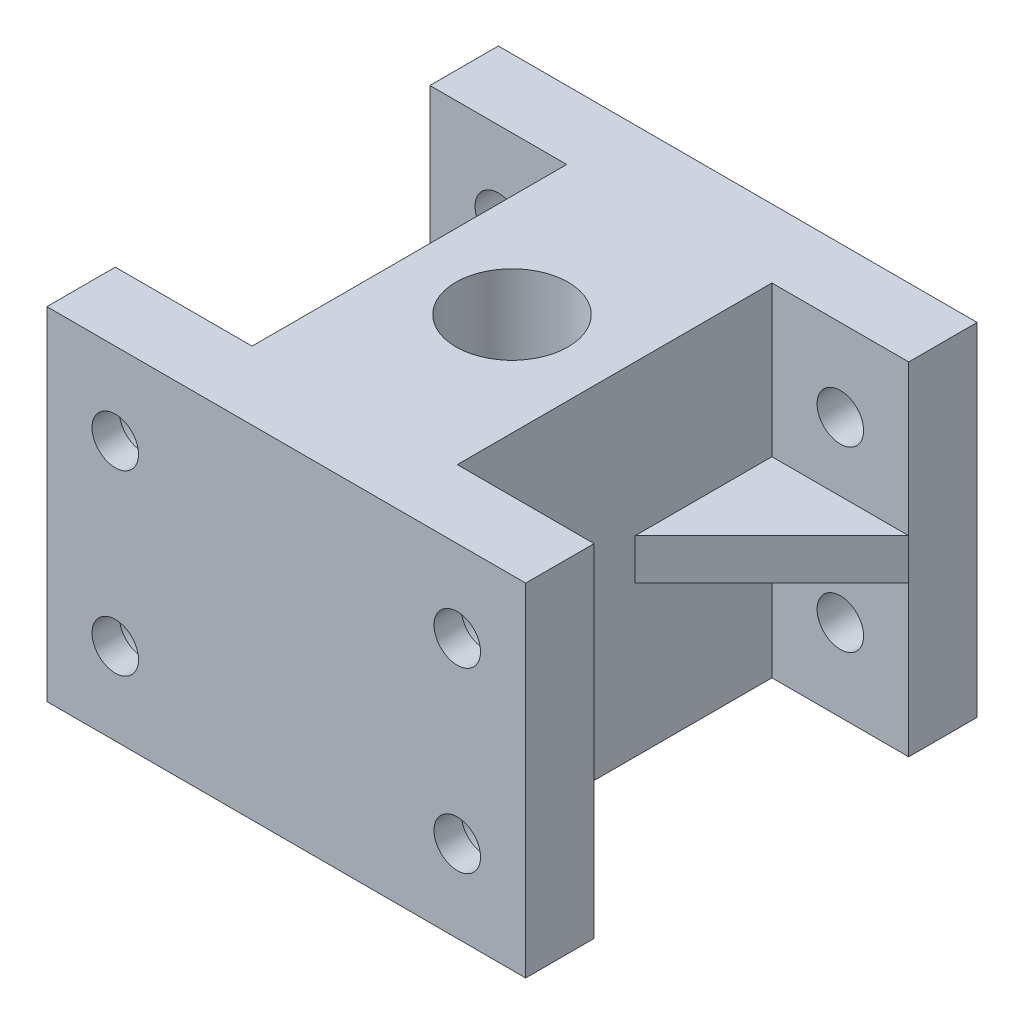
from build123d import *

# Parameters (mm, degrees)
SKETCH1_W           = 35
SKETCH1_H           = 25
SKETCH1_R           = 1.7
BOSS_EXTRUDE1_DEPTH = 5
BOSS_EXTRUDE2_DEPTH = 25
SKETCH4_R           = 1.7
CUT_EXTRUDE1_DEPTH  = 5
SKETCH5_R           = 3
SKETCH5_R_2         = 1.7
CUT_EXTRUDE3_DEPTH  = 3
BOSS_EXTRUDE3_DEPTH = 2
BOSS_EXTRUDE4_DEPTH = 1.5


with BuildPart() as part:
    # Sketch1 → Boss-Extrude1 (new body)
    with BuildSketch(Plane.XY):
        with Locations((10.173766162, 223.42362241)):
            Rectangle(SKETCH1_W, SKETCH1_H)
        with Locations((22.673766162, 216.923622409)):
            Circle(SKETCH1_R, mode=Mode.SUBTRACT)
        with Locations((22.673766162, 229.923622409)):
            Circle(SKETCH1_R, mode=Mode.SUBTRACT)
        with Locations((-2.326233838, 229.923622409)):
            Circle(SKETCH1_R, mode=Mode.SUBTRACT)
        with Locations((-2.326233838, 216.923622409)):
            Circle(SKETCH1_R, mode=Mode.SUBTRACT)
    extrude(amount=BOSS_EXTRUDE1_DEPTH)

    # Sketch3 → Boss-Extrude2 (add)
    with BuildSketch(Plane.XZ.offset(-210.92362241)):
        with BuildLine():
            Line((17.673766162, 28), (2.673766162, 28))
            Line((2.673766162, 28), (2.673766162, 16.5))
            Line((2.673766162, 16.5), (6.073766162, 16.5))
            ThreePointArc((6.073766162, 16.5), (10.173766162, 20.6), (14.273766162, 16.5))
            Line((14.273766162, 16.5), (17.673766162, 16.5))
            Line((17.673766162, 16.5), (17.673766162, 28))
        make_face()
        with BuildLine():
            Line((6.073766162, 16.5), (2.673766162, 16.5))
            Line((2.673766162, 16.5), (2.673766162, 5))
            Line((2.673766162, 5), (17.673766162, 5))
            Line((17.673766162, 5), (17.673766162, 16.5))
            Line((17.673766162, 16.5), (14.273766162, 16.5))
            ThreePointArc((14.273766162, 16.5), (10.173766162, 12.4), (6.073766162, 16.5))
        make_face()
        Polygon((27.673766162, 33), (-7.326233838, 33), (-7.326233838, 28), (2.673766162, 28), (17.673766162, 28), (27.673766162, 28), align=None)
    extrude(amount=-BOSS_EXTRUDE2_DEPTH)

    # Sketch4 → Cut-Extrude1 (cut)
    with BuildSketch(Plane(origin=(0, 0, 28), x_dir=(-1, 0, 0), z_dir=(0, 0, -1))):
        with Locations(Location((-22.673766162, 229.923622409, 0), (0, 0, 180))):
            Circle(SKETCH4_R)
        with Locations(Location((-22.673766162, 216.923622409, 0), (0, 0, 180))):
            Circle(SKETCH4_R)
        with Locations(Location((2.326233838, 229.923622409, 0), (0, 0, 180))):
            Circle(SKETCH4_R)
        with Locations(Location((2.326233838, 216.923622409, 0), (0, 0, 180))):
            Circle(SKETCH4_R)
    extrude(amount=-CUT_EXTRUDE1_DEPTH, mode=Mode.SUBTRACT)

    # Sketch5 → Cut-Extrude3 (cut)
    # profile 1 of 4: a face of its own
    with BuildSketch(Plane(origin=(0, 0, 28), x_dir=(-1, 0, 0), z_dir=(0, 0, -1))):
        with Locations((2.326233838, 216.923622409)):
            Circle(SKETCH5_R)
        with Locations((2.326233838, 216.923622409)):
            Circle(SKETCH5_R_2, mode=Mode.SUBTRACT)
    # profile 2 of 4: a face of its own
    with BuildSketch(Plane(origin=(0, 0, 28), x_dir=(-1, 0, 0), z_dir=(0, 0, -1))):
        with Locations((2.326233838, 229.923622409)):
            Circle(SKETCH5_R)
        with Locations((2.326233838, 229.923622409)):
            Circle(SKETCH5_R_2, mode=Mode.SUBTRACT)
    # profile 3 of 4: a face of its own
    with BuildSketch(Plane(origin=(0, 0, 28), x_dir=(-1, 0, 0), z_dir=(0, 0, -1))):
        with Locations((-22.673766162, 216.923622409)):
            Circle(SKETCH5_R)
        with Locations((-22.673766162, 216.923622409)):
            Circle(SKETCH5_R_2, mode=Mode.SUBTRACT)
    # profile 4 of 4: a face of its own
    with BuildSketch(Plane(origin=(0, 0, 28), x_dir=(-1, 0, 0), z_dir=(0, 0, -1))):
        with Locations((-22.673766162, 229.923622409)):
            Circle(SKETCH5_R)
        with Locations((-22.673766162, 229.923622409)):
            Circle(SKETCH5_R_2, mode=Mode.SUBTRACT)
    extrude(amount=-CUT_EXTRUDE3_DEPTH, mode=Mode.SUBTRACT)

    # Sketch6 → Boss-Extrude3 (add)
    with BuildSketch(Plane.XZ.offset(-210.92362241)):
        Polygon((-7.326233838, 0), (27.673766162, 0), (27.673766162, 5), (17.673766162, 5), (17.673766162, 28), (27.673766162, 28), (27.673766162, 33), (-7.326233838, 33), (-7.326233838, 28), (2.673766162, 28), (2.673766162, 5), (-7.326233838, 5), align=None)
    extrude(amount=-BOSS_EXTRUDE3_DEPTH)

    # Sketch7 → Boss-Extrude4 (add, symmetric)
    with BuildSketch(Plane(origin=(0, 223.42362241, 0), x_dir=(1, 0, 0), z_dir=(0, 1, 0))):
        Polygon((17.673766162, -28), (27.673766162, -28), (17.673766162, -18), align=None)
        Polygon((17.673766162, -5), (17.673766162, -15), (27.673766162, -5), align=None)
        Polygon((-7.326233838, -5), (2.673766162, -15), (2.673766162, -5), align=None)
        Polygon((2.673766162, -18), (-7.326233838, -28), (2.673766162, -28), align=None)
    extrude(amount=BOSS_EXTRUDE4_DEPTH, both=True)


solid = part.part
